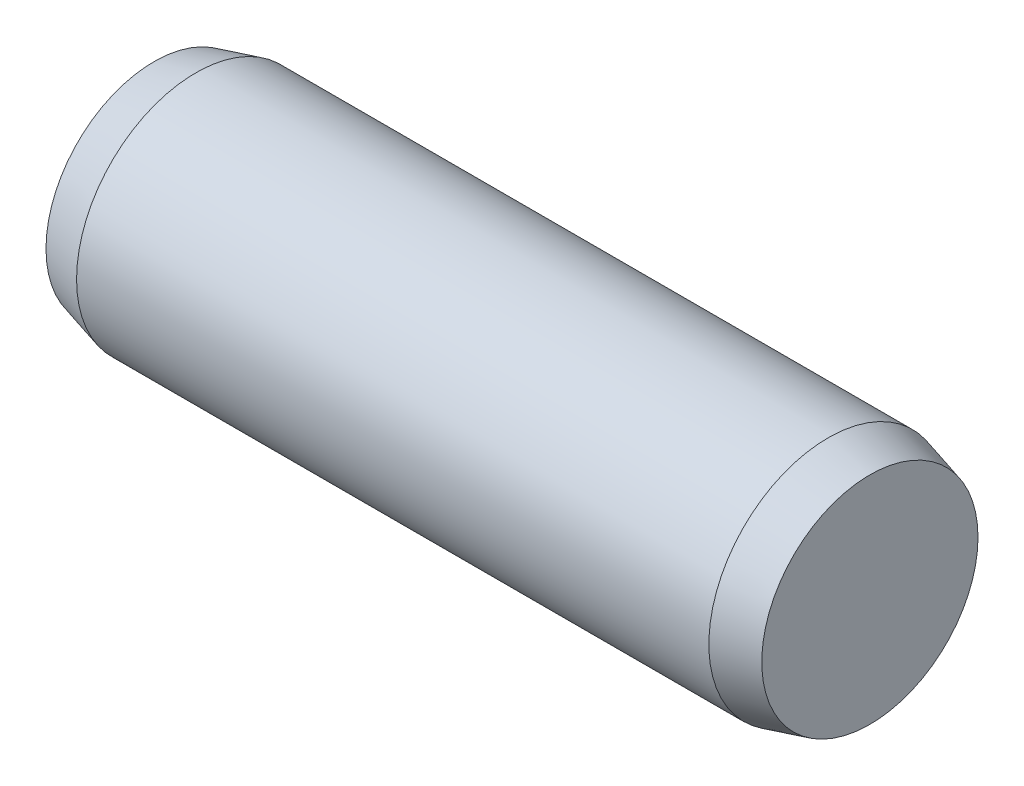
from build123d import *

# Parameters (mm, degrees)
EXTRUDE1_DEPTH      = 2.65
EXTRUDE1_DEPTH_BACK = 2.65
SKETCH2_R           = 1
SKETCH3_R           = 1
EXTRUDE2_DEPTH      = 0.35
EXTRUDE2_TAPER      = 15
SKETCH4_R           = 1
EXTRUDE3_DEPTH      = 0.35
EXTRUDE3_TAPER      = 15


with BuildPart() as part:
    # Sketch2 → Extrude1 (new, two sides: drawn at the far end of the back side and taken through both)
    with BuildSketch(Plane(origin=(0, 0, 0), x_dir=(0, 0, -1), z_dir=(1, 0, 0)).offset(-EXTRUDE1_DEPTH_BACK)):
        Circle(SKETCH2_R)
    extrude(amount=EXTRUDE1_DEPTH + EXTRUDE1_DEPTH_BACK)

    # Sketch3 → Extrude2 (add)
    with BuildSketch(Plane(origin=(2.65, 0, 0), x_dir=(0, 0, -1), z_dir=(1, 0, 0))):
        Circle(SKETCH3_R)
    extrude(amount=EXTRUDE2_DEPTH, taper=EXTRUDE2_TAPER)

    # Sketch4 → Extrude3 (add)
    with BuildSketch(Plane.ZY.offset(2.65)):
        with Locations(Location((0, 0, 0), (0, 0, 180))):
            Circle(SKETCH4_R)
    extrude(amount=EXTRUDE3_DEPTH, taper=EXTRUDE3_TAPER)


solid = part.part
